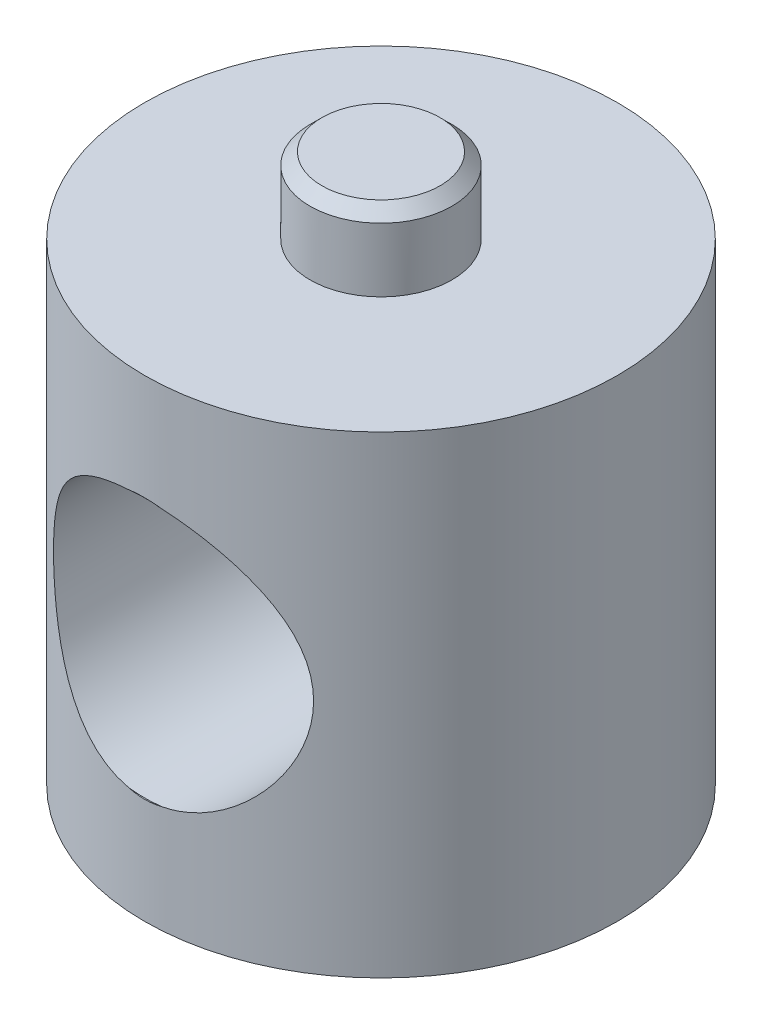
from build123d import *

# Parameters (mm, degrees)
SCHIZZO1_R                   = 10
ESTRUSIONE_ESTRUSIONE1_DEPTH = 10
SCHIZZO2_R                   = 3
ESTRUSIONE_ESTRUSIONE2_DEPTH = 3.2
SMUSSO1_SIZE                 = 0.5


with BuildPart() as part:
    # Schizzo1 → Estrusione-Estrusione1 (new, symmetric)
    with BuildSketch(Plane(origin=(0, 0, 0), x_dir=(1, 0, 0), z_dir=(0, 1, 0))):
        with Locations(Location((0, 0, 0), (0, 0, 270))):
            Circle(SCHIZZO1_R)
    extrude(amount=ESTRUSIONE_ESTRUSIONE1_DEPTH, both=True)

    # Schizzo2 → Estrusione-Estrusione2 (add)
    with BuildSketch(Plane.XZ.offset(10)):
        with Locations(Location((0, 0, 0), (0, 0, 270))):
            Circle(SCHIZZO2_R)
    estrusione_estrusione2 = extrude(amount=ESTRUSIONE_ESTRUSIONE2_DEPTH)

    # Specchia1: Estrusione-Estrusione2 across plane
    add(estrusione_estrusione2.mirror(Plane.ZX))

    # Schizzo8 → Foro per Vite M10-1 (revolve, cut)
    with BuildSketch(Plane(origin=(0, 0, 10), x_dir=(0, -1, 0), z_dir=(1, 0, 0))):
        Polygon((0, 0), (0, 20), (5.5, 20), (5.5, 0.025), (5.525, 0), align=None)
    revolve(axis=Axis((0, 0, 16.35), (0, 0, -1)), mode=Mode.SUBTRACT)

    # Smusso1
    smusso1_edges = [part.edges().sort_by_distance(p)[0] for p in [
        (0, 13.2, 3),
        (0, -13.2, 3),
    ]]
    chamfer(smusso1_edges, length=SMUSSO1_SIZE)


solid = part.part
